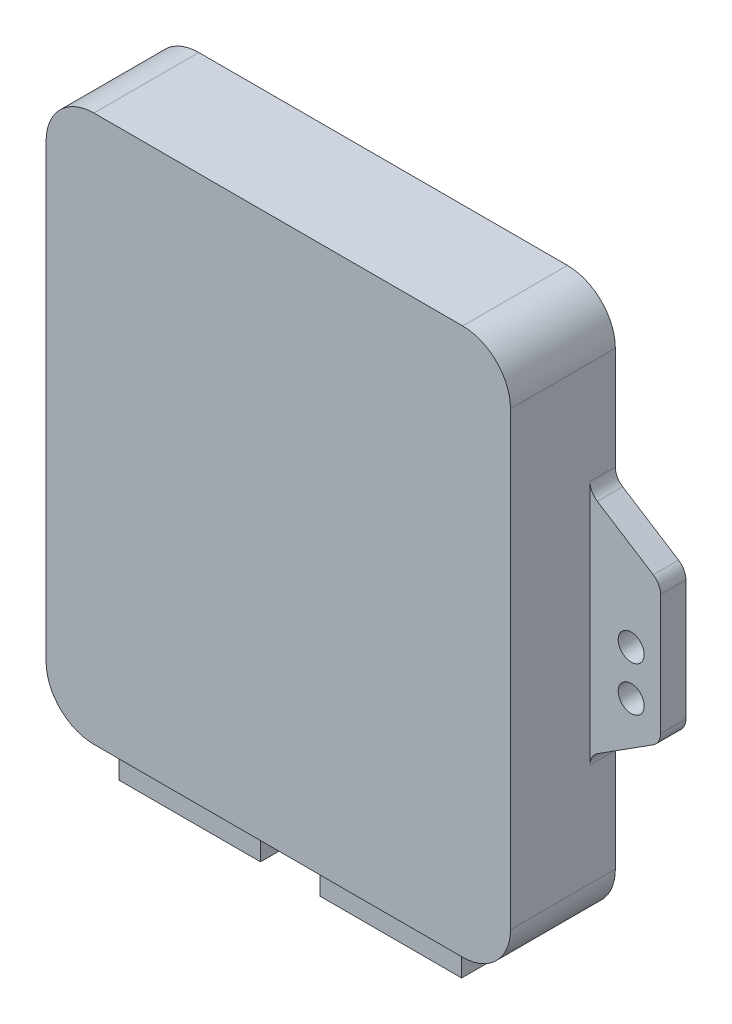
from build123d import *

# Parameters (mm, degrees)
SKETCH1_W                    = 58.25
SKETCH1_H                    = 68.58
BOSS_EXTRUDE1_DEPTH          = 6.575
FILLET1_R                    = 6
BOSS_EXTRUDE2_DEPTH          = 3.175
SKETCH6_W                    = 17.78
SKETCH6_H                    = 5.08
BOSS_EXTRUDE3_DEPTH          = 3.81
F_30_0_1285_DIAMETER_HOLE1_D = 3.2639
FILLET2_R                    = 2
CUT_EXTRUDE1_DEPTH           = 55.710248126


with BuildPart() as part:
    # Sketch1 → Boss-Extrude1 (new, symmetric)
    with BuildSketch(Plane.XY):
        Rectangle(SKETCH1_W, SKETCH1_H)
    extrude(amount=BOSS_EXTRUDE1_DEPTH, both=True)

    # Fillet1
    fillet1_edges = [part.edges().sort_by_distance(p)[0] for p in [
        (29.125, -34.29, 0),
        (-29.125, -34.29, 0),
        (-29.125, 34.29, 0),
        (29.125, 34.29, 0),
    ]]
    fillet(fillet1_edges, radius=FILLET1_R)

    # Sketch2 → Boss-Extrude2 (add)
    with BuildSketch(Plane(origin=(0, 0, -6.575), x_dir=(-1, 0, 0), z_dir=(0, 0, -1))):
        Polygon((-29.125, 14.29), (-37.975, 8.65), (-37.975, -8.65), (-29.125, -14.29), align=None)
    boss_extrude2 = extrude(amount=-BOSS_EXTRUDE2_DEPTH)

    # Sketch6 → Boss-Extrude3 (add)
    with BuildSketch(Plane.XZ.offset(34.29)):
        with Locations((-12.615, 2.54)):
            Rectangle(SKETCH6_W, SKETCH6_H)
    boss_extrude3 = extrude(amount=BOSS_EXTRUDE3_DEPTH)

    # #30 (0.1285) Diameter Hole1 (through all)
    with Locations(Plane.XY.offset(-3.4)):
        with Locations((34.29, 0), (34.29, -5.588)):
            f_30_0_1285_diameter_hole1 = Hole(F_30_0_1285_DIAMETER_HOLE1_D / 2)

    # Mirror1: Boss-Extrude2, Boss-Extrude3, #30 (0.1285) Diameter Hole1 across plane
    add(boss_extrude2.mirror(Plane(origin=(0, 0, 0), x_dir=(0, 0, 1), z_dir=(1, 0, 0))))
    add(boss_extrude3.mirror(Plane(origin=(0, 0, 0), x_dir=(0, 0, 1), z_dir=(1, 0, 0))))
    add(f_30_0_1285_diameter_hole1.mirror(Plane(origin=(0, 0, 0), x_dir=(0, 0, 1), z_dir=(1, 0, 0))), mode=Mode.SUBTRACT)

    # Fillet2
    fillet2_edges = [part.edges().sort_by_distance(p)[0] for p in [
        (29.125, 14.29, -4.9875),
        (29.125, -14.29, -4.9875),
        (37.975, -8.65, -4.9875),
        (37.975, 8.65, -4.9875),
        (-29.125, -14.29, -4.9875),
        (-29.125, 14.29, -4.9875),
        (-37.975, 8.65, -4.9875),
        (-37.975, -8.65, -4.9875),
    ]]
    fillet(fillet2_edges, radius=FILLET2_R)

    # Sketch5 → Cut-Extrude1 (cut, through all)
    with BuildSketch(Plane.XY.offset(-3.4)):
        with BuildLine():
            Line((-33.6169, -7.20725), (-34.9631, -7.20725))
            ThreePointArc((-34.9631, -7.20725), (-36.58235, -5.588), (-34.9631, -3.96875))
            Line((-34.9631, -3.96875), (-33.6169, -3.96875))
            ThreePointArc((-33.6169, -3.96875), (-31.99765, -5.588), (-33.6169, -7.20725))
        make_face()
    extrude(amount=-CUT_EXTRUDE1_DEPTH, mode=Mode.SUBTRACT)


solid = part.part
